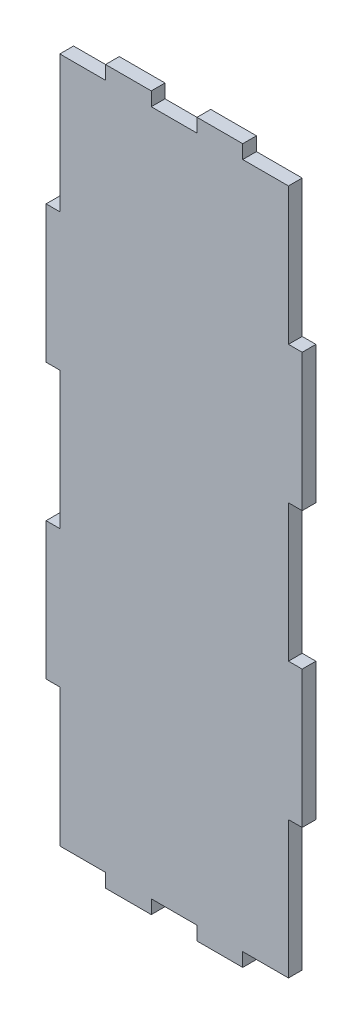
from build123d import *

# Parameters (mm, degrees)
RESSALTO_EXTRUS_O1_DEPTH = 3


with BuildPart() as part:
    # Esboço1 → Ressalto-extrusão1 (new body)
    with BuildSketch(Plane.XY):
        Polygon((-10, -20.567818439), (-10, -50.567818439), (-13, -50.567818439), (-13, -80.567818439), (-10, -80.567818439), (-10, -110.677979207), (0, -110.677979207), (0, -113.677979207), (10, -113.677979207), (10, -110.677979207), (20, -110.677979207), (20, -113.677979207), (30, -113.677979207), (30, -110.677979207), (40, -110.677979207), (40, -80.677979207), (43, -80.677979207), (43, -50.677979207), (40, -50.677979207), (40, -20.677979207), (43, -20.677979207), (43, 9.322020793), (40, 9.322020793), (40, 39.322020793), (30, 39.322020793), (30, 42.322020793), (20, 42.322020793), (20, 39.322020793), (10, 39.322020793), (10, 42.322020793), (0, 42.322020793), (0, 39.322020793), (-10, 39.322020793), (-10, 9.432181561), (-13, 9.432181561), (-13, -20.567818439), align=None)
    extrude(amount=RESSALTO_EXTRUS_O1_DEPTH)


solid = part.part
